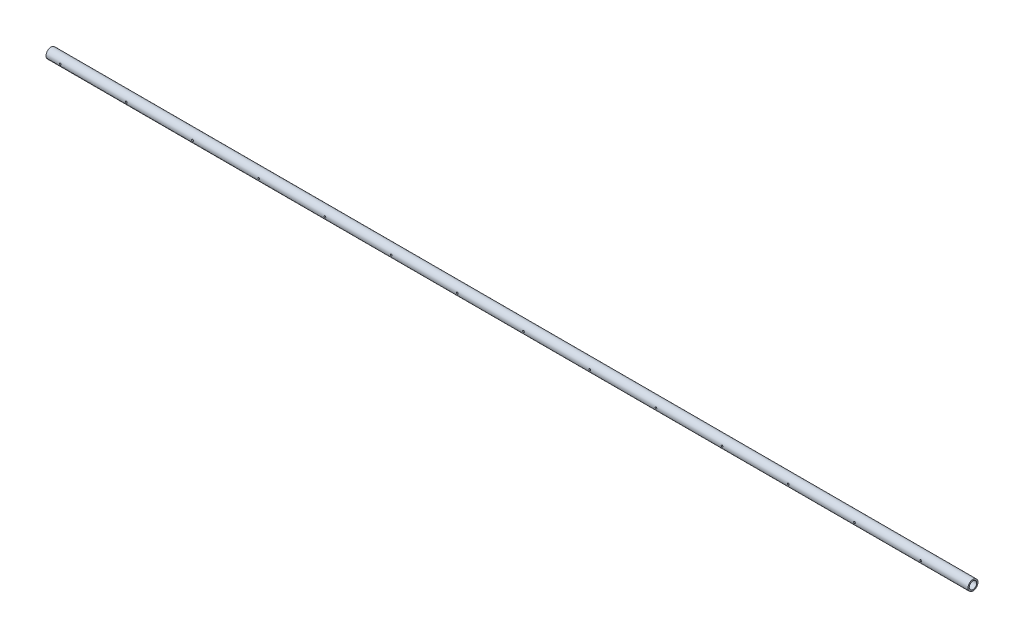
from build123d import *

# Parameters (mm, degrees)
SKETCH1_R           = 10.65
SKETCH1_R_2         = 7.88
BOSS_EXTRUDE1_DEPTH = 1950
SKETCH2_R           = 1.85
CUT_EXTRUDE1_DEPTH  = 40
LPATTERN1_COUNT     = 14
LPATTERN1_PITCH     = 140


with BuildPart() as part:
    # Sketch1 → Boss-Extrude1 (new body)
    with BuildSketch(Plane(origin=(0, 0, 0), x_dir=(0, 0, -1), z_dir=(1, 0, 0))):
        Circle(SKETCH1_R)
        Circle(SKETCH1_R_2, mode=Mode.SUBTRACT)
    extrude(amount=BOSS_EXTRUDE1_DEPTH)

    # Sketch2 → Cut-Extrude1 (cut)
    with BuildSketch(Plane.XY):
        with Locations((1850, 0)):
            Circle(SKETCH2_R)
    cut_extrude1 = extrude(amount=CUT_EXTRUDE1_DEPTH, mode=Mode.SUBTRACT)

    # LPattern1: Cut-Extrude1 ×14
    with Locations(*[(-i * LPATTERN1_PITCH, 0, 0) for i in range(1, LPATTERN1_COUNT)]):
        add(cut_extrude1, mode=Mode.SUBTRACT)


solid = part.part
